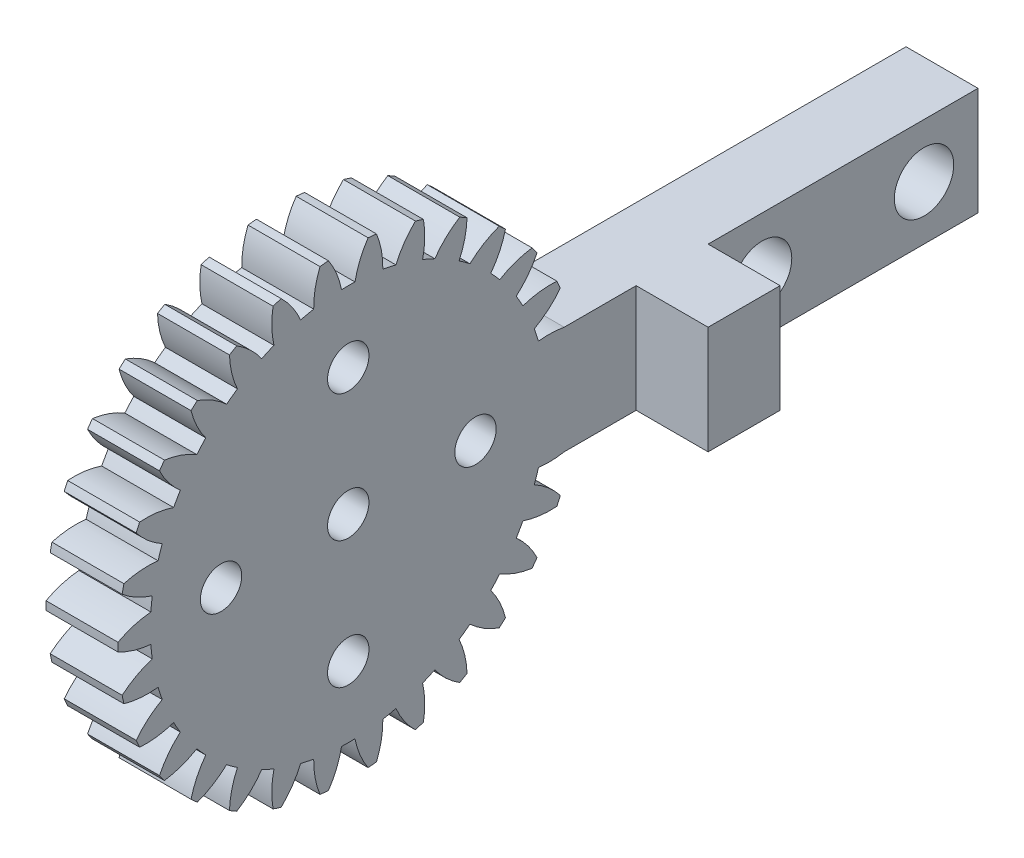
from build123d import *

# Parameters (mm, degrees)
BASPROSKE_W         = 4
BASPROSKE_H         = 12.8
TOOTHCUT_DEPTH      = 19.538608362
TEETHCUTS_COUNT     = 30
TEETHCUTS_ANGLE     = 348
BORSKE_R            = 5
BORE_DEPTH          = 50.0000508
SKETCH_1_W          = 25.456767551
SKETCH_1_H          = 6
EXTRUDE_1_DEPTH     = 4
CUT_EXTRUDE_1_REACH = 40.589
SKETCH_2_W          = 2
SKETCH_2_H          = 15
CUT_EXTRUDE_2_REACH = 39.304
SKETCH_3_R          = 1.65
EXTRUDE_START       = -4
SKETCH_4_R          = 5
EXTRUDE_2_DEPTH     = 4
CUT_EXTRUDE_3_REACH = 39.465
SKETCH_6_R          = 1.15
EXTRUDE_START_2     = 2
SKETCH_7_W          = 15
SKETCH_7_H          = 6
SKETCH_7_R          = 1.65
EXTRUDE_3_DEPTH     = 2
SKETCH_8_W          = 4
SKETCH_8_H          = 4
EXTRUDE_4_DEPTH     = 6


with BuildPart() as part:
    # BasProSke → Base-Revolve (revolve)
    with BuildSketch(Plane(origin=(0, 0, 0), x_dir=(1, 0, 0), z_dir=(0, 1, 0)), mode=Mode.PRIVATE) as base_revolve_sk:
        with Locations((2, 6.4)):
            Rectangle(BASPROSKE_W, BASPROSKE_H)
    revolve(base_revolve_sk.sketch.rotate(Axis((-10, 0, 0), (1, 0, 0)), 180), axis=Axis((-10, 0, 0), (1, 0, 0)))

    # TooCutSke → ToothCut (cut, through all)
    with BuildSketch(Plane(origin=(0, 0, 0), x_dir=(0, 0, -1), z_dir=(1, 0, 0))):
        with BuildLine():
            ThreePointArc((0.37243947, 10.992692566), (0, 10.999), (-0.37243947, 10.992692566))
            ThreePointArc((-0.37243947, 10.992692566), (-0.655704499, 11.922595954), (-1.120515575, 12.776358245))
            ThreePointArc((-1.120515575, 12.776358245), (0, 12.8254), (1.120515575, 12.776358245))
            ThreePointArc((1.120515575, 12.776358245), (0.655704499, 11.922595954), (0.37243947, 10.992692566))
        make_face()
    toothcut = extrude(amount=TOOTHCUT_DEPTH, mode=Mode.SUBTRACT)

    # TeethCuts: ToothCut ×30 about axis
    teethcuts_axis = Axis((-10, 0, 0), (1, 0, 0))
    for i in range(1, TEETHCUTS_COUNT):
        add(toothcut.rotate(teethcuts_axis, i * TEETHCUTS_ANGLE / (TEETHCUTS_COUNT - 1)), mode=Mode.SUBTRACT)

    # BorSke → Bore (cut, symmetric)
    with BuildSketch(Plane(origin=(0, 0, 0), x_dir=(0, 0, -1), z_dir=(1, 0, 0))):
        with Locations(Location((0, 0, 0), (0, 0, 180))):
            Circle(BORSKE_R)
    extrude(amount=BORE_DEPTH, both=True, mode=Mode.SUBTRACT)

    # 草图1 → 凸台-拉伸1 (add)
    with BuildSketch(Plane(origin=(4, 0, 0), x_dir=(0, 0, -1), z_dir=(1, 0, 0))):
        with Locations((22.271616225, 0)):
            Rectangle(SKETCH_1_W, SKETCH_1_H)
    extrude(amount=-EXTRUDE_1_DEPTH)

    # 草图2 → 切除-拉伸1 (cut, up to next)
    with BuildSketch(Plane(origin=(0, 3, 0), x_dir=(1, 0, 0), z_dir=(0, 1, 0)), mode=Mode.PRIVATE) as cut_extrude_1_sk1:
        with Locations((3, 27.5)):
            Rectangle(SKETCH_2_W, SKETCH_2_H)
    cut_extrude_1_tool1 = extrude(cut_extrude_1_sk1.sketch, amount=-CUT_EXTRUDE_1_REACH, mode=Mode.PRIVATE) & part.part
    add(cut_extrude_1_tool1.solids().sort_by_distance((3, 3, -27.5))[0], mode=Mode.SUBTRACT)

    # 草图3 → 切除-拉伸2 (cut, up to next)
    with BuildSketch(Plane(origin=(2, 0, 0), x_dir=(0, 0, -1), z_dir=(1, 0, 0)), mode=Mode.PRIVATE) as cut_extrude_2_sk1:
        with Locations((23, 0)):
            Circle(SKETCH_3_R)
    cut_extrude_2_tool1 = extrude(cut_extrude_2_sk1.sketch, amount=-CUT_EXTRUDE_2_REACH, mode=Mode.PRIVATE) & part.part
    # 草图3 → 切除-拉伸2 (cut, up to next)
    with BuildSketch(Plane(origin=(2, 0, 0), x_dir=(0, 0, -1), z_dir=(1, 0, 0)), mode=Mode.PRIVATE) as cut_extrude_2_sk2:
        with Locations((32, 0)):
            Circle(SKETCH_3_R)
    cut_extrude_2_tool2 = extrude(cut_extrude_2_sk2.sketch, amount=-CUT_EXTRUDE_2_REACH, mode=Mode.PRIVATE) & part.part
    add(cut_extrude_2_tool1.solids().sort_by_distance((2, 0, -23))[0], mode=Mode.SUBTRACT)
    add(cut_extrude_2_tool2.solids().sort_by_distance((2, 0, -32))[0], mode=Mode.SUBTRACT)

    # 草图4 → 凸台-拉伸2 (add)
    with BuildSketch(Plane.ZY.offset(EXTRUDE_START)):
        Circle(SKETCH_4_R)
    extrude(amount=EXTRUDE_2_DEPTH)

    # 草图6 → 切除-拉伸3 (cut, up to next)
    with BuildSketch(Plane.ZY, mode=Mode.PRIVATE) as cut_extrude_3_sk1:
        with Locations((-7.071067812, 0)):
            Circle(SKETCH_6_R)
    cut_extrude_3_tool1 = extrude(cut_extrude_3_sk1.sketch, amount=-CUT_EXTRUDE_3_REACH, mode=Mode.PRIVATE) & part.part
    # 草图6 → 切除-拉伸3 (cut, up to next)
    with BuildSketch(Plane.ZY, mode=Mode.PRIVATE) as cut_extrude_3_sk2:
        with Locations((0, 7.071067812)):
            Circle(SKETCH_6_R)
    cut_extrude_3_tool2 = extrude(cut_extrude_3_sk2.sketch, amount=-CUT_EXTRUDE_3_REACH, mode=Mode.PRIVATE) & part.part
    # 草图6 → 切除-拉伸3 (cut, up to next)
    with BuildSketch(Plane.ZY, mode=Mode.PRIVATE) as cut_extrude_3_sk3:
        with Locations((7.071067812, 0)):
            Circle(SKETCH_6_R)
    cut_extrude_3_tool3 = extrude(cut_extrude_3_sk3.sketch, amount=-CUT_EXTRUDE_3_REACH, mode=Mode.PRIVATE) & part.part
    # 草图6 → 切除-拉伸3 (cut, up to next)
    with BuildSketch(Plane.ZY, mode=Mode.PRIVATE) as cut_extrude_3_sk4:
        with Locations((0, -7.071067812)):
            Circle(SKETCH_6_R)
    cut_extrude_3_tool4 = extrude(cut_extrude_3_sk4.sketch, amount=-CUT_EXTRUDE_3_REACH, mode=Mode.PRIVATE) & part.part
    # 草图6 → 切除-拉伸3 (cut, up to next)
    with BuildSketch(Plane.ZY, mode=Mode.PRIVATE) as cut_extrude_3_sk5:
        Circle(SKETCH_6_R)
    cut_extrude_3_tool5 = extrude(cut_extrude_3_sk5.sketch, amount=-CUT_EXTRUDE_3_REACH, mode=Mode.PRIVATE) & part.part
    add(cut_extrude_3_tool1.solids().sort_by_distance((0, 0, -7.071068))[0], mode=Mode.SUBTRACT)
    add(cut_extrude_3_tool2.solids().sort_by_distance((0, 7.071068, 0))[0], mode=Mode.SUBTRACT)
    add(cut_extrude_3_tool3.solids().sort_by_distance((0, 0, 7.071068))[0], mode=Mode.SUBTRACT)
    add(cut_extrude_3_tool4.solids().sort_by_distance((0, -7.071068, 0))[0], mode=Mode.SUBTRACT)
    add(cut_extrude_3_tool5.solids().sort_by_distance((0, 0, 0))[0], mode=Mode.SUBTRACT)

    # 草图7 → 凸台-拉伸3 (add)
    with BuildSketch(Plane(origin=(2, 0, 0), x_dir=(0, 0, -1), z_dir=(1, 0, 0)).offset(EXTRUDE_START_2)):
        with Locations((27.5, 0)):
            Rectangle(SKETCH_7_W, SKETCH_7_H)
        with Locations((23, 0)):
            Circle(SKETCH_7_R, mode=Mode.SUBTRACT)
        with Locations((32, 0)):
            Circle(SKETCH_7_R, mode=Mode.SUBTRACT)
    extrude(amount=-EXTRUDE_3_DEPTH)

    # 草图8 → 凸台-拉伸4 (add)
    with BuildSketch(Plane.XZ.offset(3)):
        with Locations((6, -18)):
            Rectangle(SKETCH_8_W, SKETCH_8_H)
    extrude(amount=-EXTRUDE_4_DEPTH)


solid = part.part
